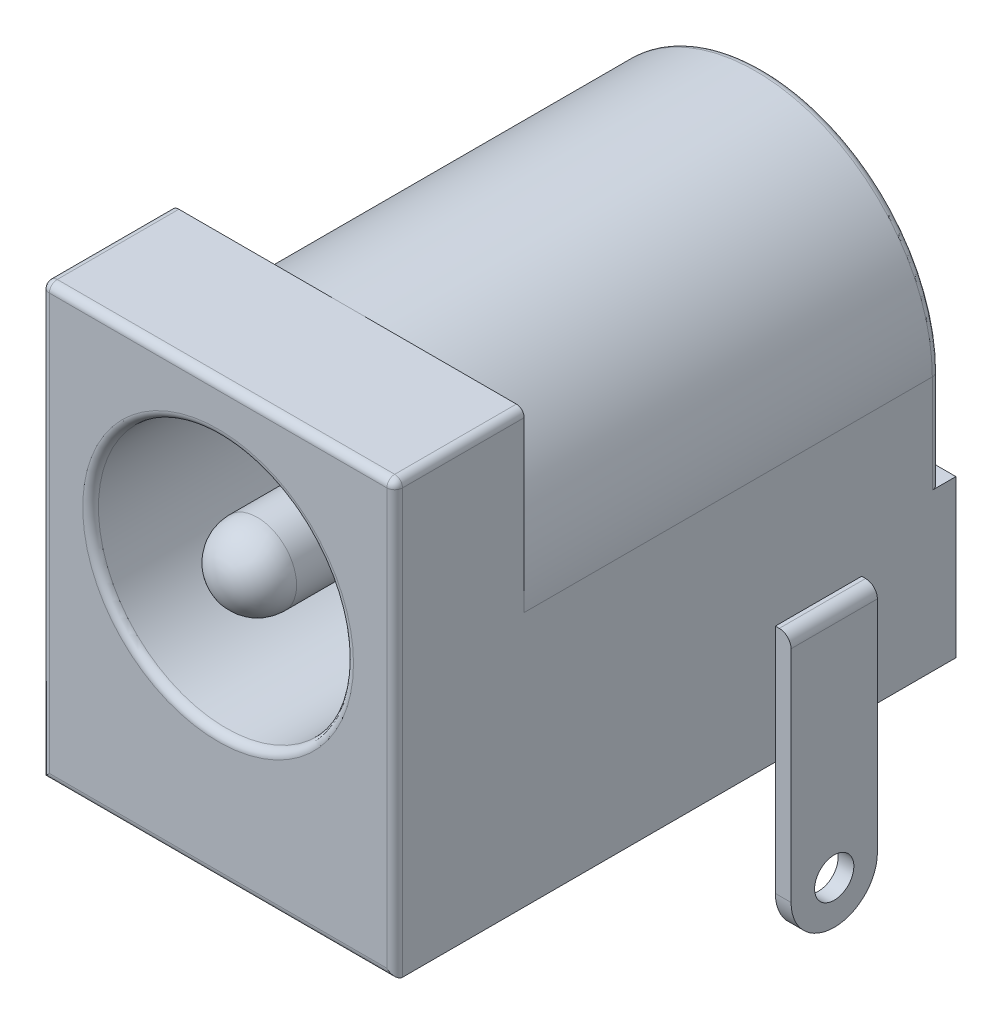
from build123d import *

# Parameters (mm, degrees)
SKETCH1_W           = 9
SKETCH1_H           = 11
BOSS_EXTRUDE1_DEPTH = 3.3
BOSS_EXTRUDE2_DEPTH = 11
SKETCH3_R           = 3.25
CUT_EXTRUDE1_DEPTH  = 11
SKETCH4_R           = 1
BOSS_EXTRUDE3_DEPTH = 11
FILLET1_R           = 1
FILLET2_R           = 0.2
CUT_EXTRUDE2_DEPTH  = 0.4
SKETCH6_R           = 0.5
BOSS_EXTRUDE4_DEPTH = 0.4
BOSS_EXTRUDE5_START = -0.4
SKETCH7_R           = 1.9
SKETCH7_R_2         = 0.5
BOSS_EXTRUDE5_DEPTH = 0.4
BOSS_EXTRUDE6_START = -0.4
SKETCH8_R           = 0.5
BOSS_EXTRUDE6_DEPTH = 0.4
SKETCH9_R           = 0.5
BOSS_EXTRUDE7_DEPTH = 0.4
SKETCH10_W          = 2.8
SKETCH10_H          = 1
BOSS_EXTRUDE8_DEPTH = 6.4
FILLET3_R           = 0.3
FILLET4_R           = 0.2


with BuildPart() as part:
    # Sketch1 → Boss-Extrude1 (new body)
    with BuildSketch(Plane.XY):
        Rectangle(SKETCH1_W, SKETCH1_H)
    extrude(amount=-BOSS_EXTRUDE1_DEPTH)

    # Sketch2 → Boss-Extrude2 (add)
    with BuildSketch(Plane(origin=(0, 0, -3.3), x_dir=(-1, 0, 0), z_dir=(0, 0, -1))):
        with BuildLine():
            Line((-4.5, -5.5), (4.5, -5.5))
            Line((4.5, -5.5), (4.5, 1))
            ThreePointArc((4.5, 1), (0, 5.5), (-4.5, 1))
            Line((-4.5, 1), (-4.5, -5.5))
        make_face()
    extrude(amount=BOSS_EXTRUDE2_DEPTH)

    # Sketch3 → Cut-Extrude1 (cut)
    with BuildSketch(Plane.XY):
        with Locations((0, 1)):
            Circle(SKETCH3_R)
    extrude(amount=-CUT_EXTRUDE1_DEPTH, mode=Mode.SUBTRACT)

    # Sketch4 → Boss-Extrude3 (add)
    with BuildSketch(Plane.XY.offset(-11)):
        with Locations((0, 1)):
            Circle(SKETCH4_R)
    extrude(amount=BOSS_EXTRUDE3_DEPTH)

    # Fillet1
    fillet1_edges = [part.edges().sort_by_distance(p)[0] for p in [
        (-1, 1, 0),
    ]]
    fillet(fillet1_edges, radius=FILLET1_R)

    # Fillet2
    fillet2_edges = [part.edges().sort_by_distance(p)[0] for p in [
        (-3.25, 1, 0),
        (0, -5.5, 0),
        (-4.5, 0, 0),
        (0, 5.5, 0),
        (4.5, 0, 0),
        (-4.5, 5.5, -1.65),
        (4.5, 5.5, -1.65),
    ]]
    fillet(fillet2_edges, radius=FILLET2_R)

    # Sketch5 → Cut-Extrude2 (cut)
    with BuildSketch(Plane(origin=(0, 0, -14.3), x_dir=(-1, 0, 0), z_dir=(0, 0, -1))):
        Polygon((4.5, -1.5), (1.2, -1.5), (1.2, -5.5), (-1.2, -5.5), (-1.2, -1.5), (-4.5, -1.5), (-4.5, 5.5), (4.5, 5.5), align=None)
    extrude(amount=-CUT_EXTRUDE2_DEPTH, mode=Mode.SUBTRACT)

    # Sketch6 → Boss-Extrude4 (add)
    with BuildSketch(Plane(origin=(0, 0, -13.9), x_dir=(-1, 0, 0), z_dir=(0, 0, -1))):
        with BuildLine():
            Line((-1.1, -8.4), (-1.1, 1))
            ThreePointArc((-1.1, 1), (0, 2.1), (1.1, 1))
            Line((1.1, 1), (1.1, -8.4))
            ThreePointArc((1.1, -8.4), (0, -9.5), (-1.1, -8.4))
        make_face()
        with Locations((0, -8.4)):
            Circle(SKETCH6_R, mode=Mode.SUBTRACT)
        with Locations((0, 1)):
            Circle(SKETCH6_R, mode=Mode.SUBTRACT)
    extrude(amount=BOSS_EXTRUDE4_DEPTH)

    # Sketch7 → Boss-Extrude5 (add)
    with BuildSketch(Plane(origin=(0, 0, -14.3), x_dir=(-1, 0, 0), z_dir=(0, 0, -1)).offset(BOSS_EXTRUDE5_START)):
        with Locations((0, 1)):
            Circle(SKETCH7_R)
        with Locations((0, 1)):
            Circle(SKETCH7_R_2, mode=Mode.SUBTRACT)
    extrude(amount=BOSS_EXTRUDE5_DEPTH)

    # Sketch8 → Boss-Extrude6 (add)
    with BuildSketch(Plane(origin=(0, 0, -8.1), x_dir=(-1, 0, 0), z_dir=(0, 0, -1)).offset(BOSS_EXTRUDE6_START)):
        with BuildLine():
            Line((-1.1, -5.145239298), (-1.1, -8.4))
            ThreePointArc((-1.1, -8.4), (0, -9.5), (1.1, -8.4))
            Line((1.1, -8.4), (1.1, -5.145239298))
            Line((1.1, -5.145239298), (-1.1, -5.145239298))
        make_face()
        with Locations((0, -8.4)):
            Circle(SKETCH8_R, mode=Mode.SUBTRACT)
    extrude(amount=BOSS_EXTRUDE6_DEPTH)

    # Sketch9 → Boss-Extrude7 (add)
    with BuildSketch(Plane(origin=(4.5, 0, 0), x_dir=(0, 0, -1), z_dir=(1, 0, 0))):
        with BuildLine():
            Line((9.7, -2.5), (9.7, -8.4))
            ThreePointArc((9.7, -8.4), (10.8, -9.5), (11.9, -8.4))
            Line((11.9, -8.4), (11.9, -2.5))
            Line((11.9, -2.5), (9.7, -2.5))
        make_face()
        with Locations(Location((10.8, -8.4, 0), (0, 0, 90))):
            Circle(SKETCH9_R, mode=Mode.SUBTRACT)
    extrude(amount=BOSS_EXTRUDE7_DEPTH)

    # Sketch10 → Boss-Extrude8 (add)
    with BuildSketch(Plane.XY.offset(-11)):
        with Locations((0, -2.25)):
            Rectangle(SKETCH10_W, SKETCH10_H)
    extrude(amount=BOSS_EXTRUDE8_DEPTH)

    # Fillet3
    fillet3_edges = [part.edges().sort_by_distance(p)[0] for p in [
        (4.9, -2.5, -10.8),
        (0, -1.75, -4.6),
    ]]
    fillet(fillet3_edges, radius=FILLET3_R)

    # Fillet4
    fillet4_edges = [part.edges().sort_by_distance(p)[0] for p in [
        (0, 5.5, -13.9),
        (4.5, -0.25, -13.9),
        (-4.5, -0.25, -13.9),
    ]]
    fillet(fillet4_edges, radius=FILLET4_R)


solid = part.part
